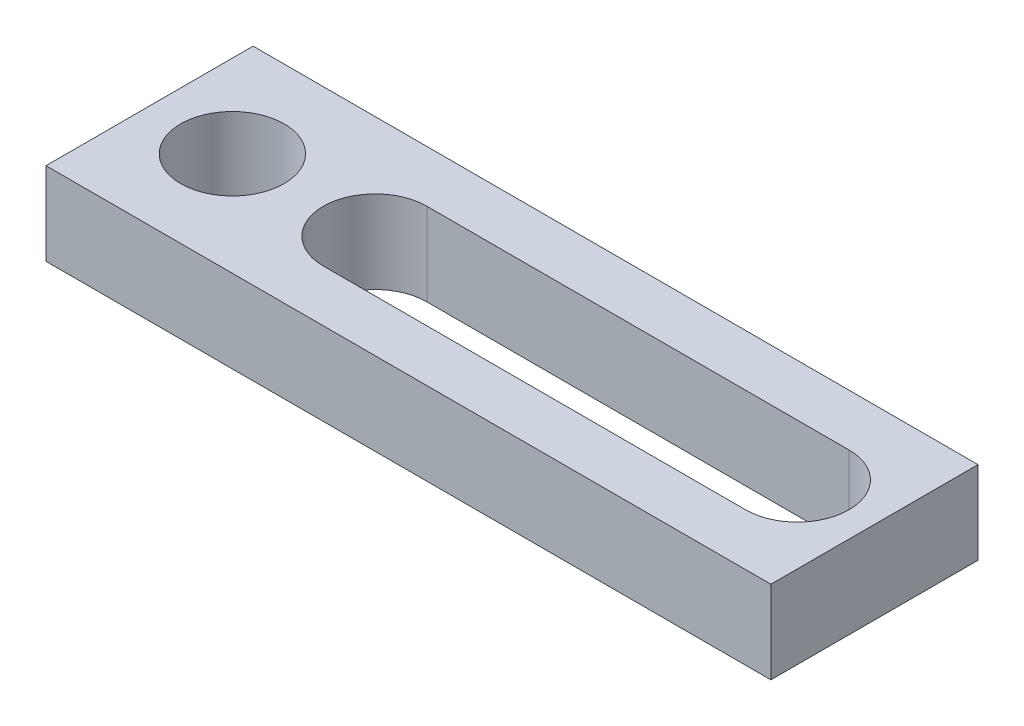
from build123d import *

# Parameters (mm, degrees)
SKETCH1_W           = 70
SKETCH1_H           = 20
SKETCH1_R           = 5
BOSS_EXTRUDE1_DEPTH = 8


with BuildPart() as part:
    # Sketch1 → Boss-Extrude1 (new body)
    with BuildSketch(Plane(origin=(0, 0, 0), x_dir=(1, 0, 0), z_dir=(0, 1, 0))):
        with Locations((-11, 4.236845834)):
            Rectangle(SKETCH1_W, SKETCH1_H)
        with Locations(Location((-38, 4.236845834, 0), (0, 0, 270))):
            Circle(SKETCH1_R, mode=Mode.SUBTRACT)
        with BuildLine():
            Line((-24.220756971, 9.236845834), (16.545795392, 9.236845834))
            ThreePointArc((16.545795392, 9.236845834), (21.545795392, 4.236845834), (16.545795392, -0.763154166))
            Line((16.545795392, -0.763154166), (-24.220756971, -0.763154166))
            ThreePointArc((-24.220756971, -0.763154166), (-29.220756971, 4.236845834), (-24.220756971, 9.236845834))
        make_face(mode=Mode.SUBTRACT)
    extrude(amount=BOSS_EXTRUDE1_DEPTH)


solid = part.part
